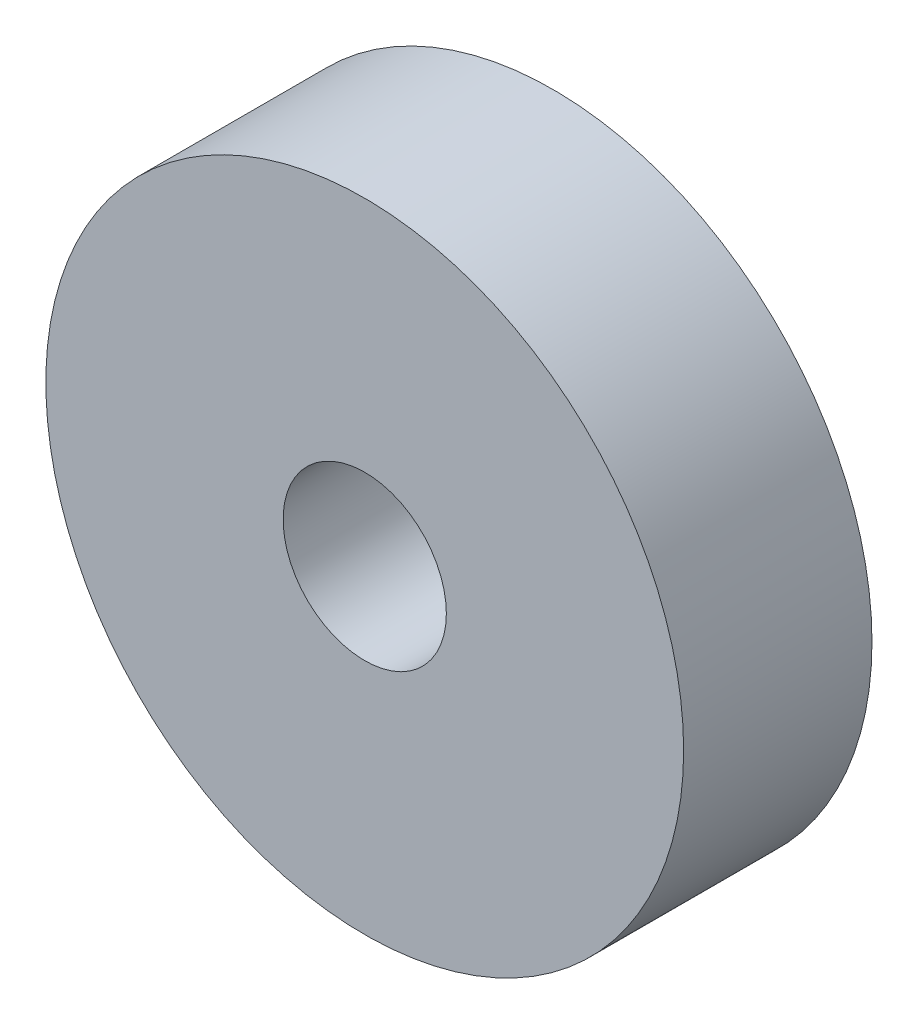
from build123d import *

# Parameters (mm, degrees)
SKETCH1_R           = 5.08
SKETCH1_R_2         = 1.3
BOSS_EXTRUDE1_DEPTH = 3


with BuildPart() as part:
    # Sketch1 → Boss-Extrude1 (new body)
    with BuildSketch(Plane.XY):
        Circle(SKETCH1_R)
        Circle(SKETCH1_R_2, mode=Mode.SUBTRACT)
    extrude(amount=BOSS_EXTRUDE1_DEPTH)


solid = part.part
